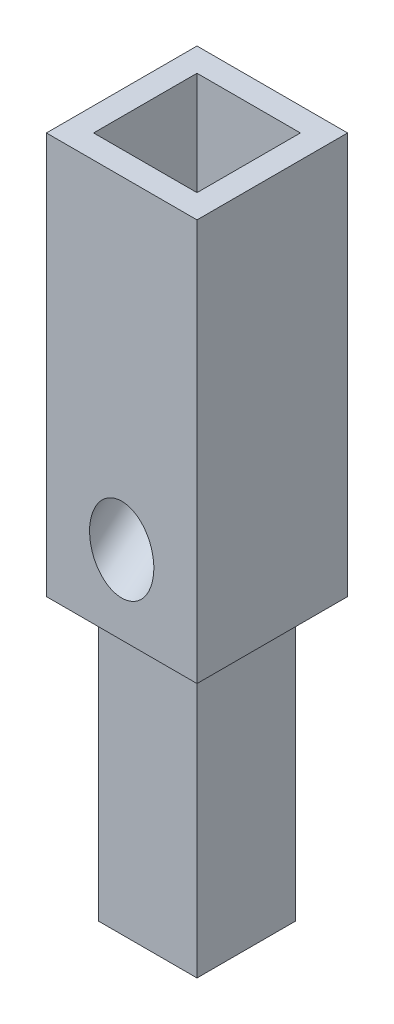
from build123d import *

# Parameters (mm, degrees)
SKETCH1_W           = 15
SKETCH1_H           = 15
BOSS_EXTRUDE1_DEPTH = 40
SKETCH2_W           = 9.8
SKETCH2_H           = 9.8
BOSS_EXTRUDE2_DEPTH = 28
SKETCH3_R           = 1.5
CUT_EXTRUDE1_DEPTH  = 69.822234779
SKETCH4_R           = 3.5
CUT_EXTRUDE2_DEPTH  = 6
SKETCH5_W           = 10.3
SKETCH5_H           = 10.3
CUT_EXTRUDE3_DEPTH  = 25
CUT_EXTRUDE8_DEPTH  = 10.3
SKETCH8_R           = 3.2
CUT_EXTRUDE10_DEPTH = 39.954720357


with BuildPart() as part:
    # Sketch1 → Boss-Extrude1 (new body)
    with BuildSketch(Plane(origin=(0, 0, 0), x_dir=(1, 0, 0), z_dir=(0, 1, 0))):
        Rectangle(SKETCH1_W, SKETCH1_H)
    extrude(amount=BOSS_EXTRUDE1_DEPTH)

    # Sketch2 → Boss-Extrude2 (add)
    with BuildSketch(Plane.XZ):
        Rectangle(SKETCH2_W, SKETCH2_H)
    extrude(amount=BOSS_EXTRUDE2_DEPTH)

    # Sketch3 → Cut-Extrude1 (cut, through all)
    with BuildSketch(Plane.XZ.offset(28)):
        with Locations(Location((0, 0, 0), (0, 0, 270))):
            Circle(SKETCH3_R)
    extrude(amount=-CUT_EXTRUDE1_DEPTH, mode=Mode.SUBTRACT)

    # Sketch4 → Cut-Extrude2 (cut)
    with BuildSketch(Plane.XZ.offset(28)):
        with Locations(Location((0, 0, 0), (0, 0, 270))):
            Circle(SKETCH4_R)
    extrude(amount=-CUT_EXTRUDE2_DEPTH, mode=Mode.SUBTRACT)

    # Sketch5 → Cut-Extrude3 (cut)
    with BuildSketch(Plane(origin=(0, 40, 0), x_dir=(1, 0, 0), z_dir=(0, 1, 0))):
        Rectangle(SKETCH5_W, SKETCH5_H)
    extrude(amount=-CUT_EXTRUDE3_DEPTH, mode=Mode.SUBTRACT)

    # Sketch6 → Cut-Extrude8 (cut)
    with BuildSketch(Plane.ZY.offset(-5.15)):
        Polygon((5.15, 15), (-4.95, 2.963288715), (-4.95, 15), align=None)
    extrude(amount=CUT_EXTRUDE8_DEPTH, mode=Mode.SUBTRACT)

    # Sketch8 → Cut-Extrude10 (cut, through all)
    with BuildSketch(Plane(origin=(0, 3.661758703, -4.36391409), x_dir=(-1, 0, 0), z_dir=(0, 0.6427876096865436, -0.7660444431189745))):
        with Locations(Location((0, 10.801022837, 0), (0, 0, 90))):
            Circle(SKETCH8_R)
    extrude(amount=-CUT_EXTRUDE10_DEPTH, mode=Mode.SUBTRACT)


solid = part.part
